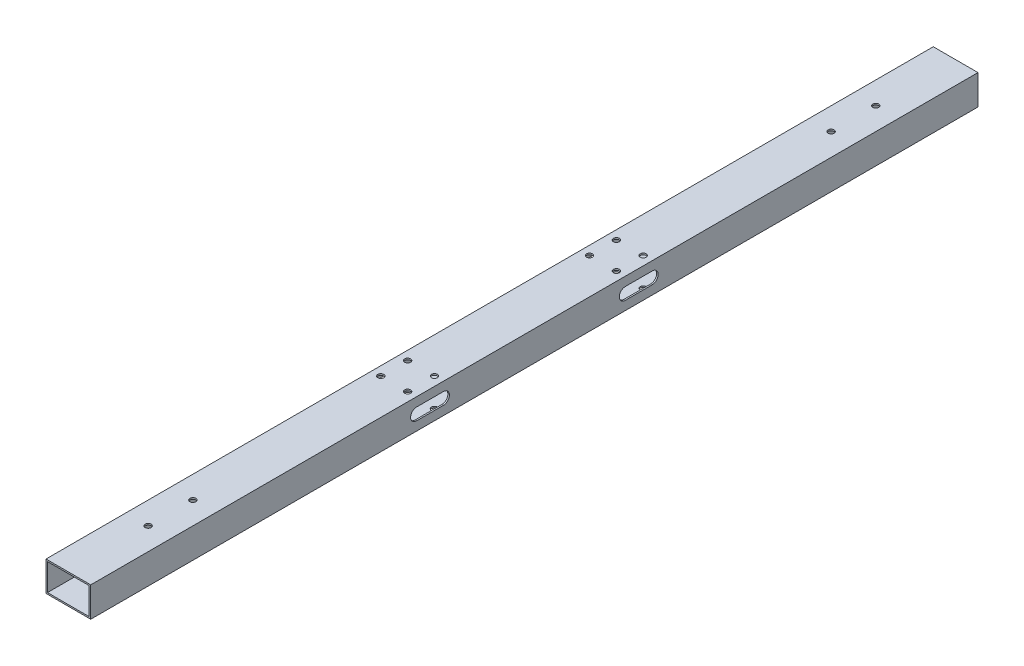
from build123d import *

# Parameters (mm, degrees)
SKETCH_1_W          = 30
SKETCH_1_H          = 20
SKETCH_1_W_2        = 28
SKETCH_1_H_2        = 18
EXTRUDE_1_DEPTH     = 297.5
SKETCH_2_R          = 2
CUT_EXTRUDE_1_DEPTH = 70
CUT_EXTRUDE_2_DEPTH = 65
SKETCH_5_R          = 2
CUT_EXTRUDE_3_DEPTH = 35


with BuildPart() as part:
    # 草图1 → 凸台-拉伸1 (new, symmetric)
    with BuildSketch(Plane.XY):
        Rectangle(SKETCH_1_W, SKETCH_1_H)
        Rectangle(SKETCH_1_W_2, SKETCH_1_H_2, mode=Mode.SUBTRACT)
    extrude(amount=EXTRUDE_1_DEPTH, both=True)

    # 草图2 → 切除-拉伸1 (cut)
    with BuildSketch(Plane(origin=(0, 10, 0), x_dir=(1, 0, 0), z_dir=(0, 1, 0))):
        with Locations(Location((9, 79, 0), (0, 0, 270))):
            Circle(SKETCH_2_R)
        with Locations(Location((-9, 79, 0), (0, 0, 270))):
            Circle(SKETCH_2_R)
        with Locations(Location((-9, 61, 0), (0, 0, 270))):
            Circle(SKETCH_2_R)
        with Locations(Location((9, 61, 0), (0, 0, 270))):
            Circle(SKETCH_2_R)
    cut_extrude_1 = extrude(amount=-CUT_EXTRUDE_1_DEPTH, mode=Mode.SUBTRACT)

    # 镜向1: 切除-拉伸1 across plane
    add(cut_extrude_1.mirror(Plane.XY), mode=Mode.SUBTRACT)

    # 草图4 → 切除-拉伸2 (cut)
    with BuildSketch(Plane(origin=(15, 0, 0), x_dir=(0, 0, -1), z_dir=(1, 0, 0))):
        with BuildLine():
            Line((-79, 4), (-61, 4))
            ThreePointArc((-61, 4), (-57, 0), (-61, -4))
            Line((-61, -4), (-79, -4))
            ThreePointArc((-79, -4), (-83, 0), (-79, 4))
        make_face()
    cut_extrude_2 = extrude(amount=-CUT_EXTRUDE_2_DEPTH, mode=Mode.SUBTRACT)

    # 镜向2: 切除-拉伸2 across plane
    add(cut_extrude_2.mirror(Plane.XY), mode=Mode.SUBTRACT)

    # 草图5 → 切除-拉伸3 (cut, symmetric)
    with BuildSketch(Plane.XZ.offset(10)):
        with Locations(Location((0, -244, 0), (0, 0, 270))):
            Circle(SKETCH_5_R)
        with Locations(Location((0, -214, 0), (0, 0, 270))):
            Circle(SKETCH_5_R)
    cut_extrude_3 = extrude(amount=CUT_EXTRUDE_3_DEPTH, both=True, mode=Mode.SUBTRACT)

    # 镜向3: 切除-拉伸3 across plane
    add(cut_extrude_3.mirror(Plane.XY), mode=Mode.SUBTRACT)


solid = part.part
